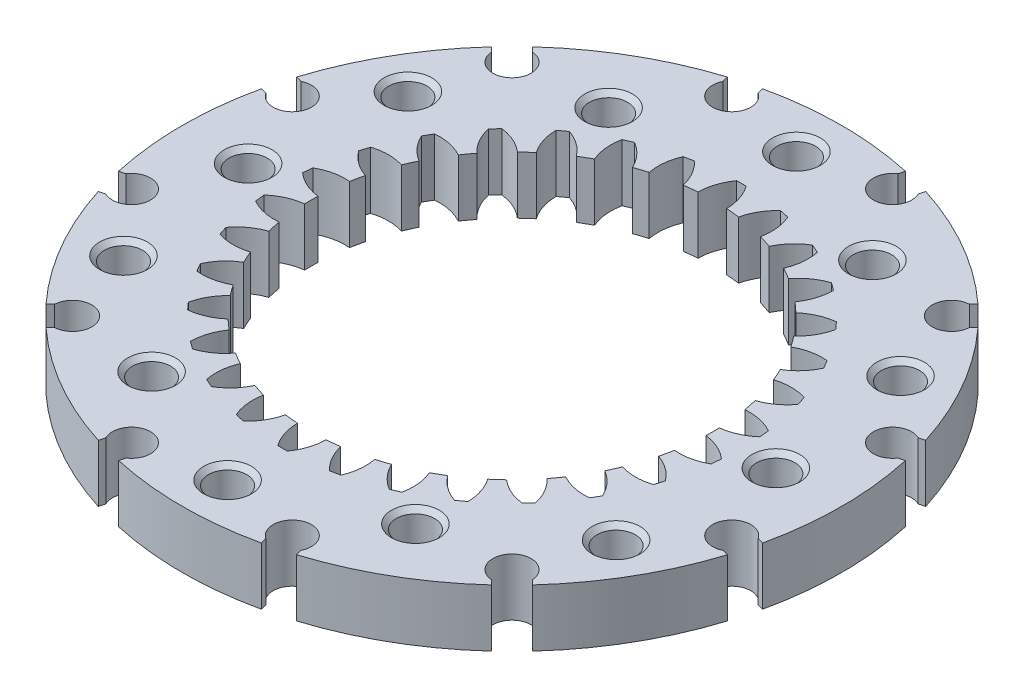
from build123d import *

# Parameters (mm, degrees)
SKETCH_1_R                           = 34.5
EXTRUDE_1_DEPTH                      = 6
SKETCH_2_R                           = 21
CUT_EXTRUDE_1_DEPTH                  = 6
CUT_EXTRUDE_2_DEPTH                  = 6
PATTERN_CIRCULAR_1_COUNT             = 30
SKETCH_4_R                           = 2
CUT_EXTRUDE_3_DEPTH                  = 6
CHAMFER_1_SIZE                       = 0.5
PATTERN_CIRCULAR_2_COUNT             = 6
CHAMFER_1_OF_PATTERN_CIRCULAR_2_SIZE = 0.5
SKETCH_5_R                           = 2
CUT_EXTRUDE_4_DEPTH                  = 6
CHAMFER_2_SIZE                       = 0.5
PATTERN_CIRCULAR_3_COUNT             = 6
CHAMFER_2_OF_PATTERN_CIRCULAR_3_SIZE = 0.5
CUT_EXTRUDE_5_DEPTH                  = 6
PATTERN_CIRCULAR_4_COUNT             = 12


with BuildPart() as part:
    # 草图1 → 凸台-拉伸1 (new body)
    with BuildSketch(Plane(origin=(0, 0, 0), x_dir=(1, 0, 0), z_dir=(0, 1, 0))):
        with Locations(Location((0, 0, 0), (0, 0, 270))):
            Circle(SKETCH_1_R)
    extrude(amount=EXTRUDE_1_DEPTH)

    # 草图2 → 切除-拉伸1 (cut)
    with BuildSketch(Plane(origin=(0, 6, 0), x_dir=(1, 0, 0), z_dir=(0, 1, 0))):
        with Locations(Location((0, 0, 0), (0, 0, 270))):
            Circle(SKETCH_2_R)
    extrude(amount=-CUT_EXTRUDE_1_DEPTH, mode=Mode.SUBTRACT)

    # 草图3 → 切除-拉伸2 (cut)
    with BuildSketch(Plane(origin=(0, 6, 0), x_dir=(1, 0, 0), z_dir=(0, 1, 0))):
        with BuildLine():
            Line((0.5, 24), (-0.5, 24))
            ThreePointArc((-0.5, 24), (-1.233981532, 22.549681375), (-1.500980633, 20.946289818))
            ThreePointArc((-1.500980633, 20.946289818), (0, 21), (1.500980633, 20.946289818))
            ThreePointArc((1.500980633, 20.946289818), (1.233981532, 22.549681375), (0.5, 24))
        make_face()
    cut_extrude_2 = extrude(amount=-CUT_EXTRUDE_2_DEPTH, mode=Mode.SUBTRACT)

    # 阵列(圆周)1: 切除-拉伸2 ×30 about axis
    pattern_circular_1_axis = Axis((0, 0, 0), (0, 1, 0))
    for i in range(1, PATTERN_CIRCULAR_1_COUNT):
        add(cut_extrude_2.rotate(pattern_circular_1_axis, i * 360 / PATTERN_CIRCULAR_1_COUNT), mode=Mode.SUBTRACT)

    # 草图4 → 切除-拉伸3 (cut)
    with BuildSketch(Plane(origin=(0, 6, 0), x_dir=(1, 0, 0), z_dir=(0, 1, 0))):
        with Locations(Location((0, 29.75, 0), (0, 0, 270))):
            Circle(SKETCH_4_R)
    cut_extrude_3 = extrude(amount=-CUT_EXTRUDE_3_DEPTH, mode=Mode.SUBTRACT)

    # 倒角1
    chamfer_1_edges = [part.edges().sort_by_distance(p)[0] for p in [
        (0, 0, -31.75),
        (0, 6, -31.75),
    ]]
    chamfer(chamfer_1_edges, length=CHAMFER_1_SIZE)

    # 阵列(圆周)2: 切除-拉伸3 ×6 about axis
    pattern_circular_2_axis = Axis((0, 0, 0), (0, 1, 0))
    for i in range(1, PATTERN_CIRCULAR_2_COUNT):
        add(cut_extrude_3.rotate(pattern_circular_2_axis, i * 360 / PATTERN_CIRCULAR_2_COUNT), mode=Mode.SUBTRACT)

    # 倒角1 of 阵列(圆周)2
    chamfer_1_of_pattern_circular_2_edges = [part.edges().sort_by_distance(p)[0] for p in [
        (-27.49630657, 0, -15.875),
        (-27.49630657, 6, -15.875),
        (-27.49630657, 0, 15.875),
        (-27.49630657, 6, 15.875),
        (0, 0, 31.75),
        (0, 6, 31.75),
        (27.49630657, 0, 15.875),
        (27.49630657, 6, 15.875),
        (27.49630657, 0, -15.875),
        (27.49630657, 6, -15.875),
    ]]
    chamfer(chamfer_1_of_pattern_circular_2_edges, length=CHAMFER_1_OF_PATTERN_CIRCULAR_2_SIZE)

    # 草图5 → 切除-拉伸4 (cut)
    with BuildSketch(Plane(origin=(0, 6, 0), x_dir=(1, 0, 0), z_dir=(0, 1, 0))):
        with Locations(Location((-13.8, 23.902301144, 0), (0, 0, 270))):
            Circle(SKETCH_5_R)
    cut_extrude_4 = extrude(amount=-CUT_EXTRUDE_4_DEPTH, mode=Mode.SUBTRACT)

    # 倒角2
    chamfer_2_edges = [part.edges().sort_by_distance(p)[0] for p in [
        (-13.8, 0, -25.902301144),
        (-13.8, 6, -25.902301144),
    ]]
    chamfer(chamfer_2_edges, length=CHAMFER_2_SIZE)

    # 阵列(圆周)3: 切除-拉伸4 ×6 about axis
    pattern_circular_3_axis = Axis((0, 0, 0), (0, 1, 0))
    for i in range(1, PATTERN_CIRCULAR_3_COUNT):
        add(cut_extrude_4.rotate(pattern_circular_3_axis, i * 360 / PATTERN_CIRCULAR_3_COUNT), mode=Mode.SUBTRACT)

    # 倒角2 of 阵列(圆周)3
    chamfer_2_of_pattern_circular_3_edges = [part.edges().sort_by_distance(p)[0] for p in [
        (-29.332050808, 0, -1),
        (-29.332050808, 6, -1),
        (-15.532050808, 0, 24.902301144),
        (-15.532050808, 6, 24.902301144),
        (13.8, 0, 25.902301144),
        (13.8, 6, 25.902301144),
        (29.332050808, 0, 1),
        (29.332050808, 6, 1),
        (15.532050808, 0, -24.902301144),
        (15.532050808, 6, -24.902301144),
    ]]
    chamfer(chamfer_2_of_pattern_circular_3_edges, length=CHAMFER_2_OF_PATTERN_CIRCULAR_3_SIZE)

    # 草图6 → 切除-拉伸5 (cut)
    with BuildSketch(Plane(origin=(0, 6, 0), x_dir=(1, 0, 0), z_dir=(0, 1, 0))):
        with BuildLine():
            Line((-7.30511564, 33.058617683), (-7.739187362, 34.678595401))
            Line((-7.739187362, 34.678595401), (-10.636964841, 33.902138266))
            Line((-10.636964841, 33.902138266), (-10.202893119, 32.282160547))
            ThreePointArc((-10.202893119, 32.282160547), (-7.893980876, 29.460737702), (-7.30511564, 33.058617683))
        make_face()
    cut_extrude_5 = extrude(amount=-CUT_EXTRUDE_5_DEPTH, mode=Mode.SUBTRACT)

    # 阵列(圆周)4: 切除-拉伸5 ×12 about axis
    pattern_circular_4_axis = Axis((0, 0, 0), (0, 1, 0))
    for i in range(1, PATTERN_CIRCULAR_4_COUNT):
        add(cut_extrude_5.rotate(pattern_circular_4_axis, i * 360 / PATTERN_CIRCULAR_4_COUNT), mode=Mode.SUBTRACT)


solid = part.part
